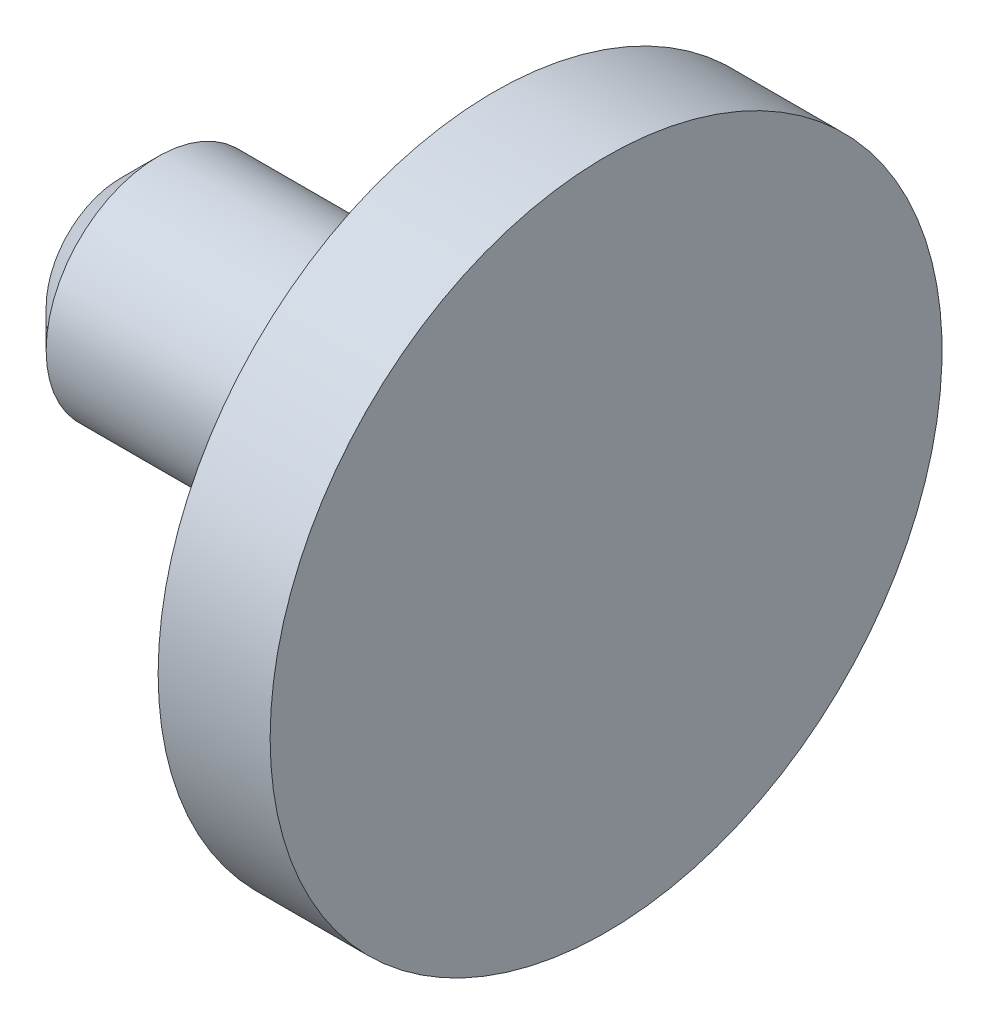
from build123d import *


with BuildPart() as part:
    # Esquisse1 → Base-Révolution (revolve)
    with BuildSketch(Plane.XY, mode=Mode.PRIVATE) as base_r_volution_sk:
        Polygon((0, 0), (0, 2), (1, 3), (10, 3), (10, 9), (13, 9), (13, 0), align=None)
    revolve(base_r_volution_sk.sketch.rotate(Axis((0, 0, 0), (1, 0, 0)), 90), axis=Axis((0, 0, 0), (1, 0, 0)))


solid = part.part
